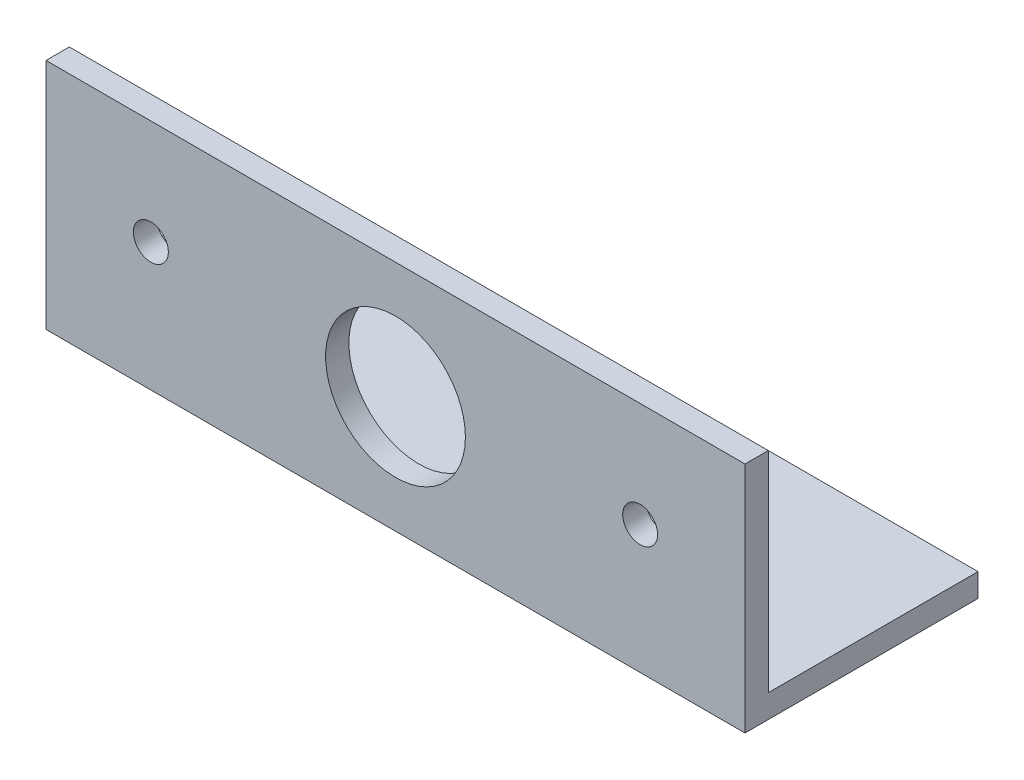
from build123d import *

# Parameters (mm, degrees)
BOSS_EXTRUDE1_DEPTH      = 30
BOSS_EXTRUDE1_DEPTH_BACK = 30
SKETCH2_R                = 1.5
SKETCH2_R_2              = 6
CUT_EXTRUDE1_DEPTH       = 2


with BuildPart() as part:
    # Sketch1 → Boss-Extrude1 (new, two sides: drawn at the far end of the back side and taken through both)
    with BuildSketch(Plane(origin=(0, 0, 0), x_dir=(0, 0, -1), z_dir=(1, 0, 0)).offset(-BOSS_EXTRUDE1_DEPTH_BACK)):
        Polygon((0, 20), (0, 0), (20, 0), (20, 2), (2, 2), (2, 20), align=None)
    extrude(amount=BOSS_EXTRUDE1_DEPTH + BOSS_EXTRUDE1_DEPTH_BACK)

    # Sketch2 → Cut-Extrude1 (cut)
    with BuildSketch(Plane.XY):
        with Locations((-21, 11)):
            Circle(SKETCH2_R)
        with Locations((21, 11)):
            Circle(SKETCH2_R)
        with Locations((0, 10)):
            Circle(SKETCH2_R_2)
    extrude(amount=-CUT_EXTRUDE1_DEPTH, mode=Mode.SUBTRACT)


solid = part.part
